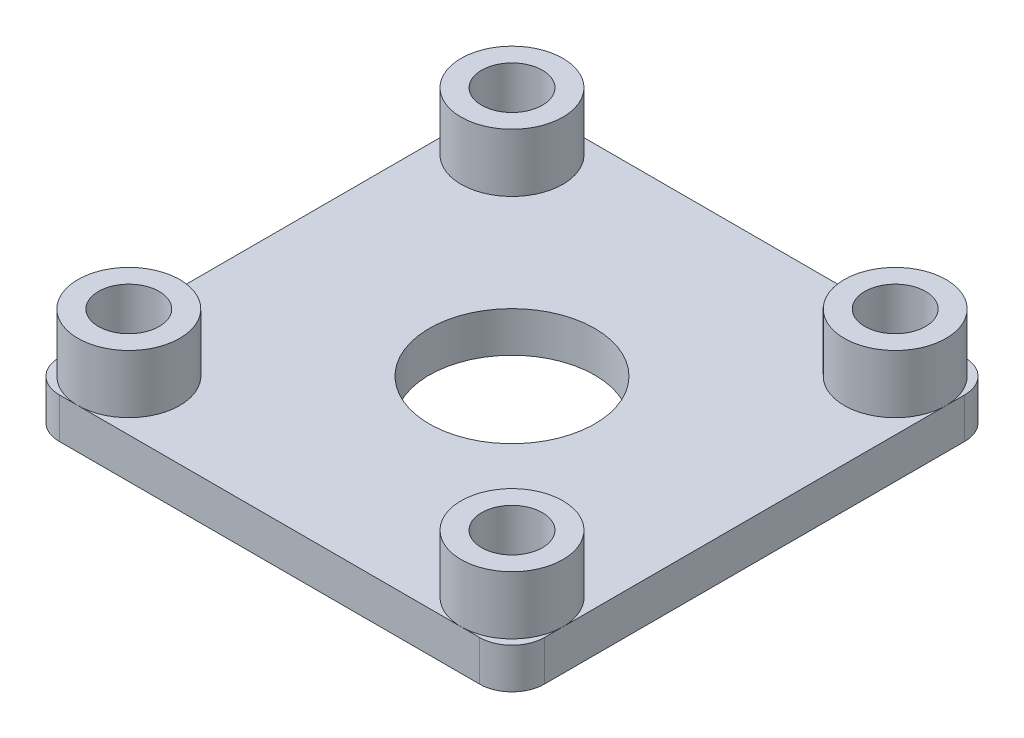
from build123d import *

# Parameters (mm, degrees)
SKETCH1_W           = 38.1
SKETCH1_H           = 38.1
SKETCH1_R           = 4
SKETCH1_R_2         = 1.5875
SKETCH1_R_3         = 1.25
BOSS_EXTRUDE1_DEPTH = 3.175
SKETCH4_R           = 1.7272
CUT_EXTRUDE2_DEPTH  = 10.795
SKETCH7_R           = 2.15265
CUT_EXTRUDE3_DEPTH  = 28.679008383
CIRPATTERN1_COUNT   = 4
SKETCH6_W           = 38.1
SKETCH6_H           = 38.1
SKETCH6_R           = 6.5
SKETCH6_R_2         = 2.15265
BOSS_EXTRUDE2_DEPTH = 3.175
FILLET1_R           = 2.54
FILLET2_R           = 2.54
SKETCH8_R           = 4
SKETCH8_R_2         = 2.3876
BOSS_EXTRUDE3_DEPTH = 4.572
CIRPATTERN2_COUNT   = 4


with BuildPart() as part:
    # Sketch1 → Boss-Extrude1 (new, symmetric)
    with BuildSketch(Plane(origin=(0, 0, 0), x_dir=(1, 0, 0), z_dir=(0, 1, 0))):
        Rectangle(SKETCH1_W, SKETCH1_H)
        with Locations(Location((0, 0, 0), (0, 0, 270))):
            Circle(SKETCH1_R, mode=Mode.SUBTRACT)
        with Locations(Location((8.838834765, 8.838834765, 0), (0, 0, 270))):
            Circle(SKETCH1_R_2, mode=Mode.SUBTRACT)
        with Locations(Location((8.838834765, -8.838834765, 0), (0, 0, 270))):
            Circle(SKETCH1_R_2, mode=Mode.SUBTRACT)
        with Locations(Location((-8.838834765, -8.838834765, 0), (0, 0, 270))):
            Circle(SKETCH1_R_2, mode=Mode.SUBTRACT)
        with Locations(Location((-8.838834765, 8.838834765, 0), (0, 0, 270))):
            Circle(SKETCH1_R_2, mode=Mode.SUBTRACT)
        with Locations(Location((-14.5, 0, 0), (0, 0, 270))):
            Circle(SKETCH1_R_3, mode=Mode.SUBTRACT)
        with Locations(Location((0, 14.5, 0), (0, 0, 270))):
            Circle(SKETCH1_R_3, mode=Mode.SUBTRACT)
        with Locations(Location((14.5, 0, 0), (0, 0, 270))):
            Circle(SKETCH1_R_3, mode=Mode.SUBTRACT)
        with Locations(Location((0, -14.5, 0), (0, 0, 270))):
            Circle(SKETCH1_R_3, mode=Mode.SUBTRACT)
    extrude(amount=BOSS_EXTRUDE1_DEPTH, both=True)

    # Sketch4 → Cut-Extrude2 (cut)
    with BuildSketch(Plane.XY.offset(19.05)):
        with Locations((-5.55625, 0)):
            Circle(SKETCH4_R)
        with Locations((5.55625, 0)):
            Circle(SKETCH4_R)
    cut_extrude2 = extrude(amount=-CUT_EXTRUDE2_DEPTH, mode=Mode.SUBTRACT)

    # Sketch7 → Cut-Extrude3 (cut, through all)
    with BuildSketch(Plane.XZ.offset(3.175)):
        with Locations(Location((-15.05, 15.05, 0), (0, 0, 270))):
            Circle(SKETCH7_R)
        with Locations(Location((15.05, 15.05, 0), (0, 0, 270))):
            Circle(SKETCH7_R)
        with Locations(Location((15.05, -15.05, 0), (0, 0, 270))):
            Circle(SKETCH7_R)
        with Locations(Location((-15.05, -15.05, 0), (0, 0, 270))):
            Circle(SKETCH7_R)
    extrude(amount=-CUT_EXTRUDE3_DEPTH, mode=Mode.SUBTRACT)

    # CirPattern1: Cut-Extrude2 ×4 about axis
    cirpattern1_axis = Axis((0, 0, 0), (0, 1, 0))
    for i in range(1, CIRPATTERN1_COUNT):
        add(cut_extrude2.rotate(cirpattern1_axis, i * 360 / CIRPATTERN1_COUNT), mode=Mode.SUBTRACT)

    # Fillet1
    fillet1_edges = [part.edges().sort_by_distance(p)[0] for p in [
        (19.05, 0, 19.05),
        (-19.05, 0, 19.05),
        (-19.05, 0, -19.05),
        (19.05, 0, -19.05),
    ]]
    fillet(fillet1_edges, radius=FILLET1_R)


with BuildPart() as body_2:
    # Sketch6 → Boss-Extrude2 (new body)
    with BuildSketch(Plane(origin=(0, -32.512, 0), x_dir=(-1, 0, 0), z_dir=(0, -1, 0))):
        Rectangle(SKETCH6_W, SKETCH6_H)
        with Locations(Location((0, 0, 0), (0, 0, 90))):
            Circle(SKETCH6_R, mode=Mode.SUBTRACT)
        with Locations(Location((-15.05, 15.05, 0), (0, 0, 90))):
            Circle(SKETCH6_R_2, mode=Mode.SUBTRACT)
        with Locations(Location((15.05, 15.05, 0), (0, 0, 90))):
            Circle(SKETCH6_R_2, mode=Mode.SUBTRACT)
        with Locations(Location((15.05, -15.05, 0), (0, 0, 90))):
            Circle(SKETCH6_R_2, mode=Mode.SUBTRACT)
        with Locations(Location((-15.05, -15.05, 0), (0, 0, 90))):
            Circle(SKETCH6_R_2, mode=Mode.SUBTRACT)
    extrude(amount=BOSS_EXTRUDE2_DEPTH)

    # Fillet2
    fillet2_edges = [body_2.edges().sort_by_distance(p)[0] for p in [
        (-19.05, -34.0995, 19.05),
        (19.05, -34.0995, 19.05),
        (19.05, -34.0995, -19.05),
        (-19.05, -34.0995, -19.05),
    ]]
    fillet(fillet2_edges, radius=FILLET2_R)


with BuildPart() as body_3:
    # Sketch8 → Boss-Extrude3 (new body)
    with BuildSketch(Plane(origin=(0, -32.512, 0), x_dir=(1, 0, 0), z_dir=(0, 1, 0))):
        with Locations(Location((-15.05, 15.05, 0), (0, 0, 270))):
            Circle(SKETCH8_R)
        with Locations(Location((-15.05, 15.05, 0), (0, 0, 270))):
            Circle(SKETCH8_R_2, mode=Mode.SUBTRACT)
    extrude(amount=BOSS_EXTRUDE3_DEPTH)


with BuildPart() as cirpattern2_1:
    # CirPattern2: pattern copy
    add(body_3.part.rotate(Axis((0, 0, 0), (0, 1, 0)), 1 * 360 / CIRPATTERN2_COUNT))


with BuildPart() as cirpattern2_2:
    # CirPattern2: pattern copy
    add(body_3.part.rotate(Axis((0, 0, 0), (0, 1, 0)), 2 * 360 / CIRPATTERN2_COUNT))


with BuildPart() as cirpattern2_3:
    # CirPattern2: pattern copy
    add(body_3.part.rotate(Axis((0, 0, 0), (0, 1, 0)), 3 * 360 / CIRPATTERN2_COUNT))


solid = Compound([body_2.part, body_3.part, cirpattern2_1.part, cirpattern2_2.part, cirpattern2_3.part])
